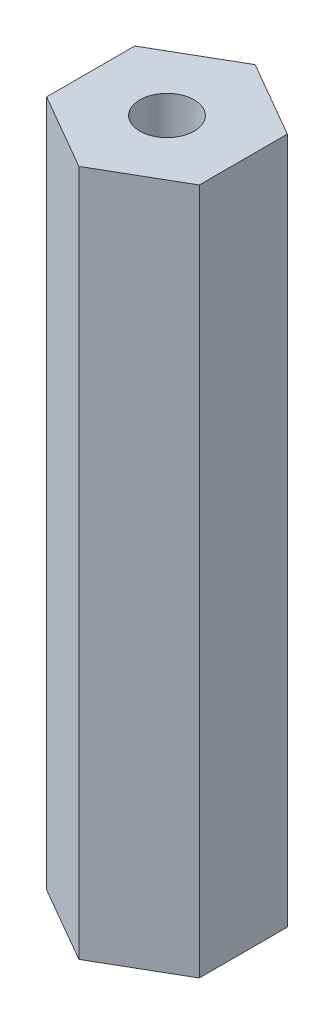
from build123d import *

# Parameters (mm, degrees)
BOSS_EXTRUDE1_DEPTH   = 28.575
F_4_40_TAPPED_HOLE1_D = 2.2606


with BuildPart() as part:
    # Sketch2 → Boss-Extrude1 (new body)
    with BuildSketch(Plane(origin=(0, 0, 0), x_dir=(1, 0, 0), z_dir=(0, 1, 0))):
        Polygon((0, 3.666174209), (-3.175, 1.833087105), (-3.175, -1.833087105), (0, -3.666174209), (3.175, -1.833087105), (3.175, 1.833087105), align=None)
    extrude(amount=BOSS_EXTRUDE1_DEPTH)

    # #4-40 Tapped Hole1 (through all)
    with Locations(Plane(origin=(0, 28.575, 0), x_dir=(-1, 0, 0), z_dir=(0, 1, 0))):
        with Locations((0, 0)):
            Hole(F_4_40_TAPPED_HOLE1_D / 2)


solid = part.part
